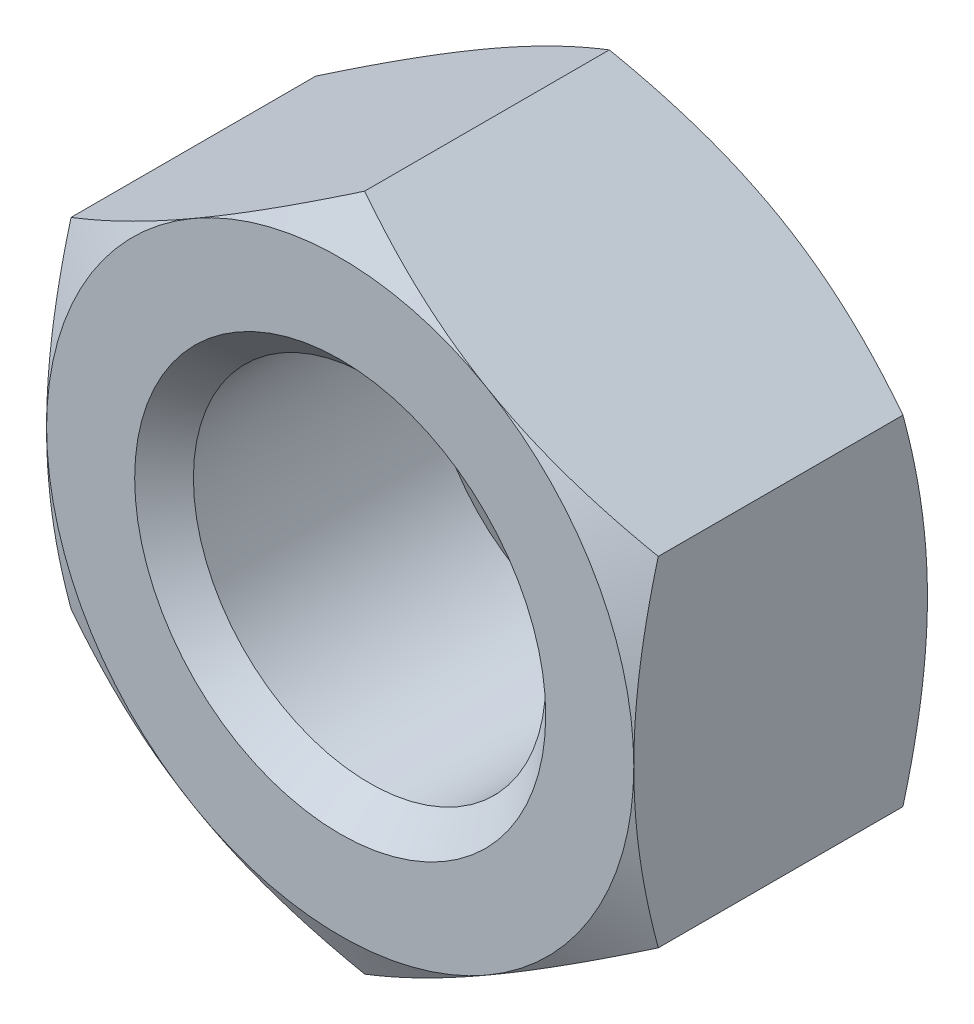
from build123d import *

# Parameters (mm, degrees)
SKETCH1_R           = 3
BOSS_EXTRUDE1_DEPTH = 5


with BuildPart() as part:
    # Sketch1 → Boss-Extrude1 (new body)
    with BuildSketch(Plane.XY):
        Polygon((0, -5.773502692), (5, -2.886751346), (5, 2.886751346), (0, 5.773502692), (-5, 2.886751346), (-5, -2.886751346), align=None)
        Circle(SKETCH1_R, mode=Mode.SUBTRACT)
    extrude(amount=BOSS_EXTRUDE1_DEPTH)

    # Sketch2 → Cut-Revolve1 (revolve, cut)
    with BuildSketch(Plane(origin=(0, 0, 0), x_dir=(0, 0, -1), z_dir=(1, 0, 0)), mode=Mode.PRIVATE) as cut_revolve1_sk:
        Polygon((-5, 5.773502692), (-5, 5), (-4.583333333, 5.773502692), align=None)
        Polygon((-0.416666667, 5.773502692), (0, 5.773502692), (0, 5), align=None)
        Polygon((-5, 3), (-4.5, 3), (-5, 3.5), align=None)
        Polygon((0, 3), (-0.5, 3), (0, 3.5), align=None)
    revolve(cut_revolve1_sk.sketch.rotate(Axis((0, 0, 0), (0, 0, 1)), 90), axis=Axis((0, 0, 0), (0, 0, 1)), mode=Mode.SUBTRACT)


solid = part.part
